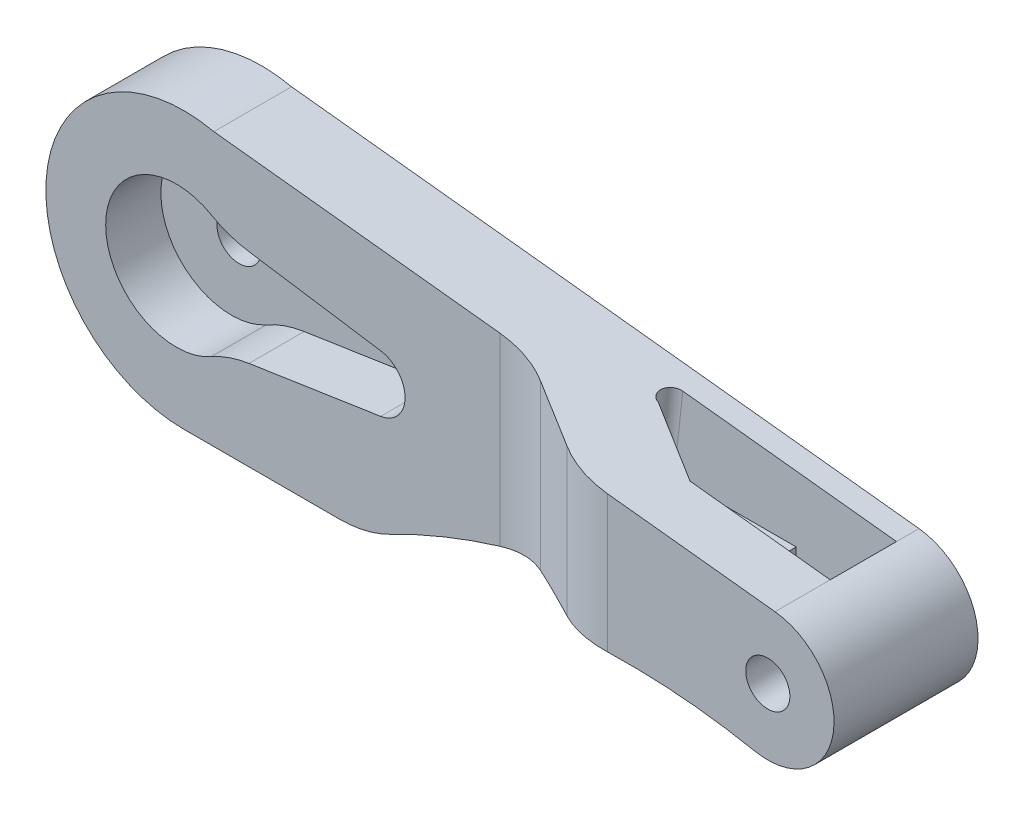
from build123d import *

# Parameters (mm, degrees)
EXTRUDE_1_DEPTH     = 4.04
EXTRUDE_START       = 3
EXTRUDE_2_DEPTH     = 3
EXTRUDE_3_DEPTH     = 6
CUT_EXTRUDE_1_DEPTH = 69.95015268178993
CUT_EXTRUDE_2_DEPTH = 5
DRAFT_1_ANGLE       = 60.000000000000234
CUT_EXTRUDE_3_REACH = 69.351
SKETCH_6_R          = 2.000000000000003
SKETCH_7_R          = 2.002237129098131
CUT_EXTRUDE_4_DEPTH = 5
RIB_1_REACH         = 68.835
SKETCH_8_WALL_W     = 141.6697430182401
SKETCH_8_WALL_H     = 2
FILLET_1_R          = 10
FILLET_2_R          = 10


with BuildPart() as part:
    # 草图1 → 凸台-拉伸1 (new body)
    with BuildSketch(Plane.XY):
        with BuildLine():
            Line((2.711712708194342, 12.202320033019019), (59.53806556534447, 5.964171430093859))
            ThreePointArc((59.53806556534447, 5.964171430093859), (64.81417632321985, -0.9084264437888516), (57.72286495852592, -5.886704197633859))
            ThreePointArc((57.72286495852592, -5.886704197633859), (36.58461274967972, -5.515977162880489), (16.63, -12.5))
            Line((16.63, -12.5), (0, -12.5))
            ThreePointArc((0, -12.5), (-12.425357146028794, 1.364001390626533), (2.711712708194342, 12.202320033019019))
        make_face()
    extrude(amount=EXTRUDE_1_DEPTH)

    # 草图2 → 凸台-拉伸2 (add)
    with BuildSketch(Plane(origin=(0, 0, 0), x_dir=(-1, 0, 0), z_dir=(0, 0, -1)).offset(EXTRUDE_START)):
        with BuildLine():
            Line((-16.629999999999995, -12.500000000000004), (2.3e-15, -12.5))
            ThreePointArc((2.3e-15, -12.5), (12.425357146028796, 1.3640013906265342), (-2.711712708194334, 12.202320033019022))
            Line((-2.711712708194334, 12.202320033019022), (-59.53806556534447, 5.964171430093854))
            ThreePointArc((-59.53806556534447, 5.964171430093854), (-64.81417632321985, -0.9084264437888536), (-57.72286495852591, -5.886704197633859))
            ThreePointArc((-57.72286495852591, -5.886704197633859), (-36.584612749679714, -5.515977162880482), (-16.629999999999995, -12.500000000000004))
        make_face()
    extrude(amount=-EXTRUDE_2_DEPTH)

    # 草图3 → 凸台-拉伸3 (add)
    with BuildSketch(Plane.XY.offset(4.04)):
        with BuildLine():
            Line((31.302864958525912, 9.063708323856956), (59.53806556534447, 5.964171430093859))
            ThreePointArc((59.53806556534447, 5.964171430093859), (64.81417632321985, -0.9084264437888548), (57.72286495852591, -5.886704197633853))
            ThreePointArc((57.72286495852591, -5.886704197633853), (44.47245462008017, -4.776317380993831), (31.302864958525912, -6.611594244587196))
            Line((31.302864958525912, -6.611594244587196), (31.302864958525912, 9.063708323856956))
        make_face()
    extrude(amount=EXTRUDE_3_DEPTH)

    # 草图4 → 切除-拉伸1 (cut, through all)
    with BuildSketch(Plane(origin=(1.3558563540964497, 12.351160016509516, 0), x_dir=(0.9940285716823101, -0.10912011125006546, 0), z_dir=(0.10912011125006545, 0.99402857168231, 0))):
        with BuildLine():
            Line((45.761727224680776, -5.039999999999999), (58.53172722468078, -5.04))
            Line((58.53172722468078, -5.04), (58.53172722468078, 0.96))
            Line((58.53172722468078, 0.96), (39.06172722468078, 0.9599999999999976))
            ThreePointArc((39.06172722468078, 0.9599999999999976), (38.05523868595962, 0.06182278930871615), (38.83352399440517, -1.040000000000001))
            Line((38.83352399440517, -1.040000000000001), (45.761727224680776, -5.039999999999999))
        make_face()
    extrude(amount=-CUT_EXTRUDE_1_DEPTH, mode=Mode.SUBTRACT)

    # 草图5 → 切除-拉伸2 (cut)
    with BuildSketch(Plane.XY.offset(4.04)):
        with BuildLine():
            Line((3.6299942497491204, 4.727481587079438), (17.823503151893238, 2.570486685801488))
            ThreePointArc((17.823503151893238, 2.570486685801488), (20.032864958525913, 0), (17.823503151893238, -2.5704866858014865))
            Line((17.823503151893238, -2.5704866858014865), (3.62999424974912, -4.72748158707944))
            ThreePointArc((3.62999424974912, -4.72748158707944), (-7.084043052340996, 7.8e-16), (3.6299942497491204, 4.727481587079438))
        make_face()
    extrude(amount=-CUT_EXTRUDE_2_DEPTH, mode=Mode.SUBTRACT)

    # 拔模1
    draft_1_faces = [part.faces().sort_by_distance(p)[0] for p in [
        (31.302864958525912, 1.226057039634884, 7.04),
    ]]
    draft(draft_1_faces, Plane(origin=(58.88334489784406, 0, 4.04), x_dir=(1, 0, 0), z_dir=(0, 0, 1)), DRAFT_1_ANGLE)

    # 切除-拉伸3: up to this face of the body (flat: up to its plane)
    cut_extrude_3_end = Plane(part.part.faces().sort_by_distance((20.783576678, 0.227997431, -3))[0])
    # 草图6 → 切除-拉伸3 (cut, up to the picked face)
    with BuildSketch(Plane.XY.offset(10.040000000000001), mode=Mode.PRIVATE) as cut_extrude_3_sk1:
        with Locations((58.88334489784406, 0)):
            Circle(SKETCH_6_R)
    cut_extrude_3_tool1 = split(extrude(cut_extrude_3_sk1.sketch, amount=-CUT_EXTRUDE_3_REACH, mode=Mode.PRIVATE), bisect_by=cut_extrude_3_end, keep=Keep.BOTH, mode=Mode.PRIVATE)
    add(cut_extrude_3_tool1.solids().sort_by(Axis((58.883345, 0, 10.04), (0, 0, -1)))[0], mode=Mode.SUBTRACT)

    # 草图7 → 切除-拉伸4 (cut)
    with BuildSketch(Plane.XY.offset(-0.96)):
        Circle(SKETCH_7_R)
    extrude(amount=-CUT_EXTRUDE_4_DEPTH, mode=Mode.SUBTRACT)

    # 草图8 wall → 筋1 (add, up to next)
    with BuildSketch(Plane(origin=(50.454320705, 0, 2.04), x_dir=(0, 0, -1), z_dir=(-1, 0, 0)), mode=Mode.PRIVATE) as rib_1_sk1:
        Rectangle(SKETCH_8_WALL_W, SKETCH_8_WALL_H)
    rib_1_tool1 = extrude(rib_1_sk1.sketch, amount=RIB_1_REACH, mode=Mode.PRIVATE) - part.part
    add(rib_1_tool1.solids().sort_by_distance((50.454320705, 0, 2.04))[0])

    # 圆角1
    fillet_1_edges = [part.edges().sort_by_distance(p)[0] for p in [
        (16.629999999999992, -12.5, 0.52),
    ]]
    fillet(fillet_1_edges, radius=FILLET_1_R)

    # 圆角2
    fillet_2_edges = [part.edges().sort_by_distance(p)[0] for p in [
        (31.302864958525912, 1.2260570396348758, 4.04),
        (41.69516980393928, 1.5029507858131876, 10.04),
        (3.629994249749121, 4.727481587079438, 1.54),
        (3.62999424974912, -4.72748158707944, 1.54),
    ]]
    fillet(fillet_2_edges, radius=FILLET_2_R)


solid = part.part
